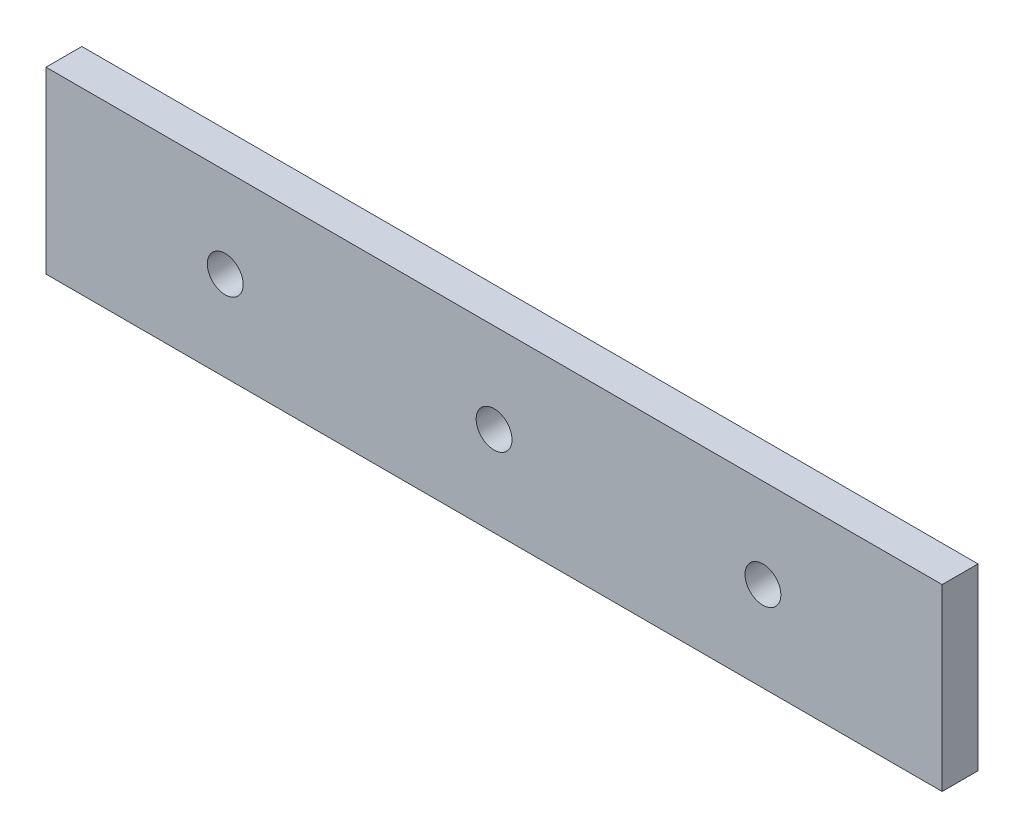
from build123d import *

# Parameters (mm, degrees)
SKETCH1_W           = 75
SKETCH1_H           = 15
SKETCH1_R           = 1.5
BOSS_EXTRUDE1_DEPTH = 3


with BuildPart() as part:
    # Sketch1 → Boss-Extrude1 (new body)
    with BuildSketch(Plane.XY):
        with Locations((37.5, 7.5)):
            Rectangle(SKETCH1_W, SKETCH1_H)
        with Locations((15, 7.5)):
            Circle(SKETCH1_R, mode=Mode.SUBTRACT)
        with Locations((37.5, 7.5)):
            Circle(SKETCH1_R, mode=Mode.SUBTRACT)
        with Locations((60, 7.5)):
            Circle(SKETCH1_R, mode=Mode.SUBTRACT)
    extrude(amount=BOSS_EXTRUDE1_DEPTH)


solid = part.part
